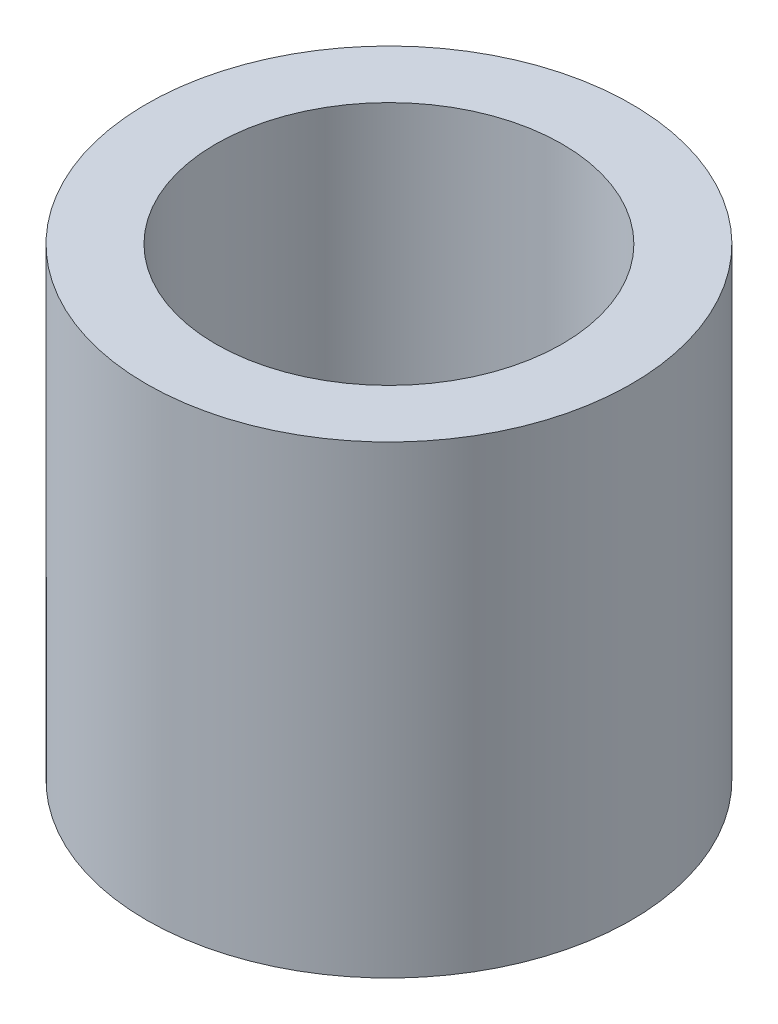
from build123d import *

# Parameters (mm, degrees)
SKETCH1_R           = 3.5
SKETCH1_R_2         = 2.5
BOSS_EXTRUDE1_DEPTH = 6.7


with BuildPart() as part:
    # Sketch1 → Boss-Extrude1 (new body)
    with BuildSketch(Plane(origin=(0, 0, 0), x_dir=(1, 0, 0), z_dir=(0, 1, 0))):
        with Locations(Location((0, 0, 0), (0, 0, 270))):
            Circle(SKETCH1_R)
        with Locations(Location((0, 0, 0), (0, 0, 270))):
            Circle(SKETCH1_R_2, mode=Mode.SUBTRACT)
    extrude(amount=BOSS_EXTRUDE1_DEPTH)


solid = part.part
